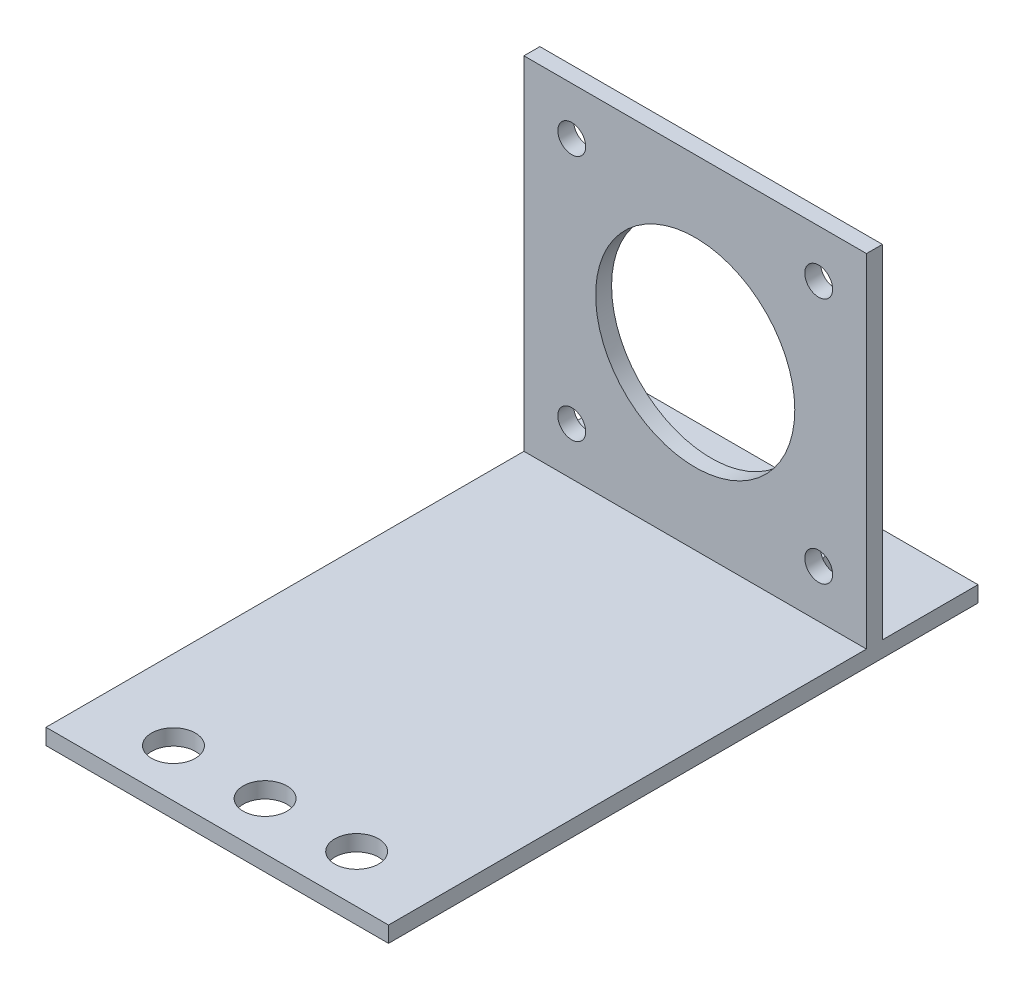
from build123d import *

# Parameters (mm, degrees)
SKETCH1_W           = 43
SKETCH1_H           = 2
BOSS_EXTRUDE1_DEPTH = 43
SKETCH1_3_W         = 43
SKETCH1_3_H         = 74
BOSS_EXTRUDE2_DEPTH = 2
CUT_EXTRUDE1_REACH  = 78.885
SKETCH2_R           = 12.5
SKETCH2_R_2         = 1.75
CUT_EXTRUDE2_REACH  = 62.665
SKETCH1_4_R         = 2.75
LPATTERN1_COUNT     = 2
LPATTERN1_PITCH     = 11.5
LPATTERN1_COL_COUNT = 2
LPATTERN1_COL_PITCH = 11.5


with BuildPart() as part:
    # Sketch1 → Boss-Extrude1 (new body)
    with BuildSketch(Plane(origin=(0, 0, 0), x_dir=(1, 0, 0), z_dir=(0, 1, 0))):
        with Locations((0, 24)):
            Rectangle(SKETCH1_W, SKETCH1_H)
    extrude(amount=BOSS_EXTRUDE1_DEPTH)

    # Sketch1<3> → Boss-Extrude2 (add)
    with BuildSketch(Plane(origin=(0, 0, 0), x_dir=(1, 0, 0), z_dir=(0, 1, 0))):
        Rectangle(SKETCH1_3_W, SKETCH1_3_H)
    extrude(amount=-BOSS_EXTRUDE2_DEPTH)

    # Sketch2 → Cut-Extrude1 (cut, up to next)
    with BuildSketch(Plane.XY.offset(-23), mode=Mode.PRIVATE) as cut_extrude1_sk1:
        with Locations((0, 21.5)):
            Circle(SKETCH2_R)
    cut_extrude1_tool1 = extrude(cut_extrude1_sk1.sketch, amount=-CUT_EXTRUDE1_REACH, mode=Mode.PRIVATE) & part.part
    # Sketch2 → Cut-Extrude1 (cut, up to next)
    with BuildSketch(Plane.XY.offset(-23), mode=Mode.PRIVATE) as cut_extrude1_sk2:
        with Locations((-15.5, 37)):
            Circle(SKETCH2_R_2)
    cut_extrude1_tool2 = extrude(cut_extrude1_sk2.sketch, amount=-CUT_EXTRUDE1_REACH, mode=Mode.PRIVATE) & part.part
    # Sketch2 → Cut-Extrude1 (cut, up to next)
    with BuildSketch(Plane.XY.offset(-23), mode=Mode.PRIVATE) as cut_extrude1_sk3:
        with Locations((15.5, 37)):
            Circle(SKETCH2_R_2)
    cut_extrude1_tool3 = extrude(cut_extrude1_sk3.sketch, amount=-CUT_EXTRUDE1_REACH, mode=Mode.PRIVATE) & part.part
    # Sketch2 → Cut-Extrude1 (cut, up to next)
    with BuildSketch(Plane.XY.offset(-23), mode=Mode.PRIVATE) as cut_extrude1_sk4:
        with Locations((15.5, 6)):
            Circle(SKETCH2_R_2)
    cut_extrude1_tool4 = extrude(cut_extrude1_sk4.sketch, amount=-CUT_EXTRUDE1_REACH, mode=Mode.PRIVATE) & part.part
    # Sketch2 → Cut-Extrude1 (cut, up to next)
    with BuildSketch(Plane.XY.offset(-23), mode=Mode.PRIVATE) as cut_extrude1_sk5:
        with Locations((-15.5, 6)):
            Circle(SKETCH2_R_2)
    cut_extrude1_tool5 = extrude(cut_extrude1_sk5.sketch, amount=-CUT_EXTRUDE1_REACH, mode=Mode.PRIVATE) & part.part
    add(cut_extrude1_tool1.solids().sort_by_distance((0, 21.5, -23))[0], mode=Mode.SUBTRACT)
    add(cut_extrude1_tool2.solids().sort_by_distance((-15.5, 37, -23))[0], mode=Mode.SUBTRACT)
    add(cut_extrude1_tool3.solids().sort_by_distance((15.5, 37, -23))[0], mode=Mode.SUBTRACT)
    add(cut_extrude1_tool4.solids().sort_by_distance((15.5, 6, -23))[0], mode=Mode.SUBTRACT)
    add(cut_extrude1_tool5.solids().sort_by_distance((-15.5, 6, -23))[0], mode=Mode.SUBTRACT)

    # Sketch1<4> → Cut-Extrude2 (cut, up to next)
    with BuildSketch(Plane(origin=(0, 0, 0), x_dir=(1, 0, 0), z_dir=(0, 1, 0)), mode=Mode.PRIVATE) as cut_extrude2_sk1:
        with Locations((0, 31)):
            Circle(SKETCH1_4_R)
    cut_extrude2_tool1 = extrude(cut_extrude2_sk1.sketch, amount=-CUT_EXTRUDE2_REACH, mode=Mode.PRIVATE) & part.part
    # Sketch1<4> → Cut-Extrude2 (cut, up to next)
    with BuildSketch(Plane(origin=(0, 0, 0), x_dir=(1, 0, 0), z_dir=(0, 1, 0)), mode=Mode.PRIVATE) as cut_extrude2_sk2:
        with Locations((0, -31)):
            Circle(SKETCH1_4_R)
    cut_extrude2_tool2 = extrude(cut_extrude2_sk2.sketch, amount=-CUT_EXTRUDE2_REACH, mode=Mode.PRIVATE) & part.part
    cut_extrude2_1 = cut_extrude2_tool1.solids().sort_by_distance((0, 0, -31))[0]
    add(cut_extrude2_1, mode=Mode.SUBTRACT)
    cut_extrude2_2 = cut_extrude2_tool2.solids().sort_by_distance((0, 0, 31))[0]
    add(cut_extrude2_2, mode=Mode.SUBTRACT)
    cut_extrude2 = cut_extrude2_1 + cut_extrude2_2  # Cut-Extrude2 as one shape, for the pattern or mirror that repeats it

    # LPattern1: Cut-Extrude2 ×2
    with Locations(*[(i * LPATTERN1_PITCH, 0, 0) for i in range(1, LPATTERN1_COUNT)]):
        add(cut_extrude2, mode=Mode.SUBTRACT)

    # LPattern1 col: Cut-Extrude2 ×2
    with Locations(*[(-i * LPATTERN1_COL_PITCH, 0, 0) for i in range(1, LPATTERN1_COL_COUNT)]):
        add(cut_extrude2, mode=Mode.SUBTRACT)


solid = part.part
